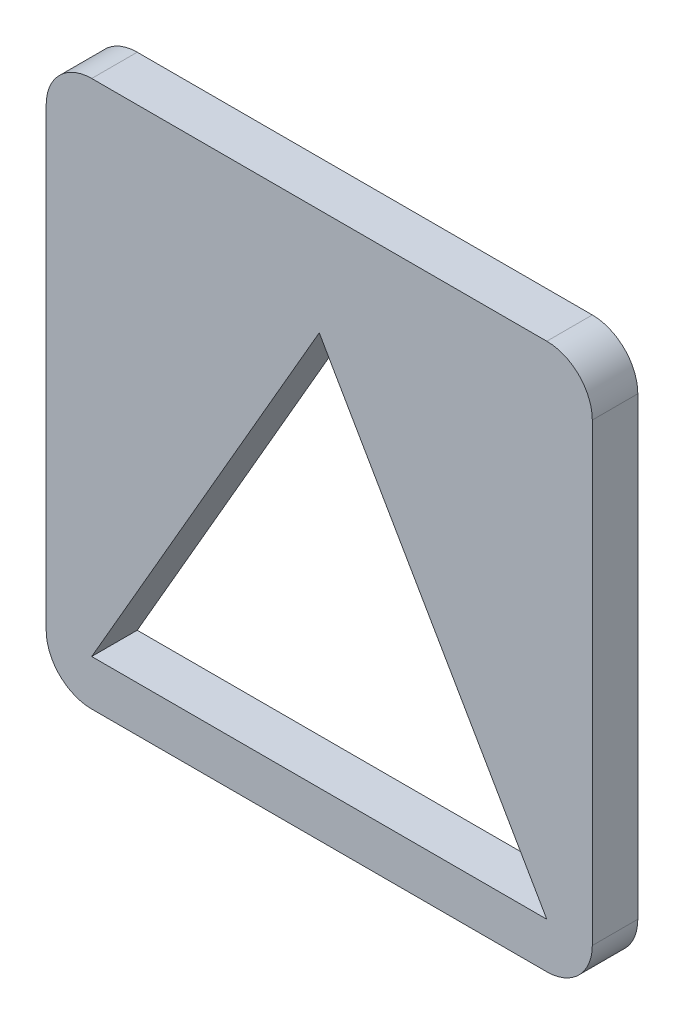
from build123d import *

# Parameters (mm, degrees)
BOSS_EXTRUDE1_DEPTH = 10
CUT_EXTRUDE1_DEPTH  = 10


with BuildPart() as part:
    # Sketch1 → Boss-Extrude1 (new body)
    with BuildSketch(Plane.XY):
        with BuildLine():
            Line((-50, 60), (50, 60))
            ThreePointArc((50, 60), (57.071067812, 57.071067812), (60, 50))
            Line((60, 50), (60, -50))
            ThreePointArc((60, -50), (57.071067812, -57.071067812), (50, -60))
            Line((50, -60), (-50, -60))
            ThreePointArc((-50, -60), (-57.071067812, -57.071067812), (-60, -50))
            Line((-60, -50), (-60, 50))
            ThreePointArc((-60, 50), (-57.071067812, 57.071067812), (-50, 60))
        make_face()
    extrude(amount=BOSS_EXTRUDE1_DEPTH)

    # Sketch3 → Cut-Extrude1 (cut)
    with BuildSketch(Plane.XY.offset(10)):
        Polygon((-50, -50), (50, -50), (0, 36.602540378), align=None)
    extrude(amount=-CUT_EXTRUDE1_DEPTH, mode=Mode.SUBTRACT)


solid = part.part
